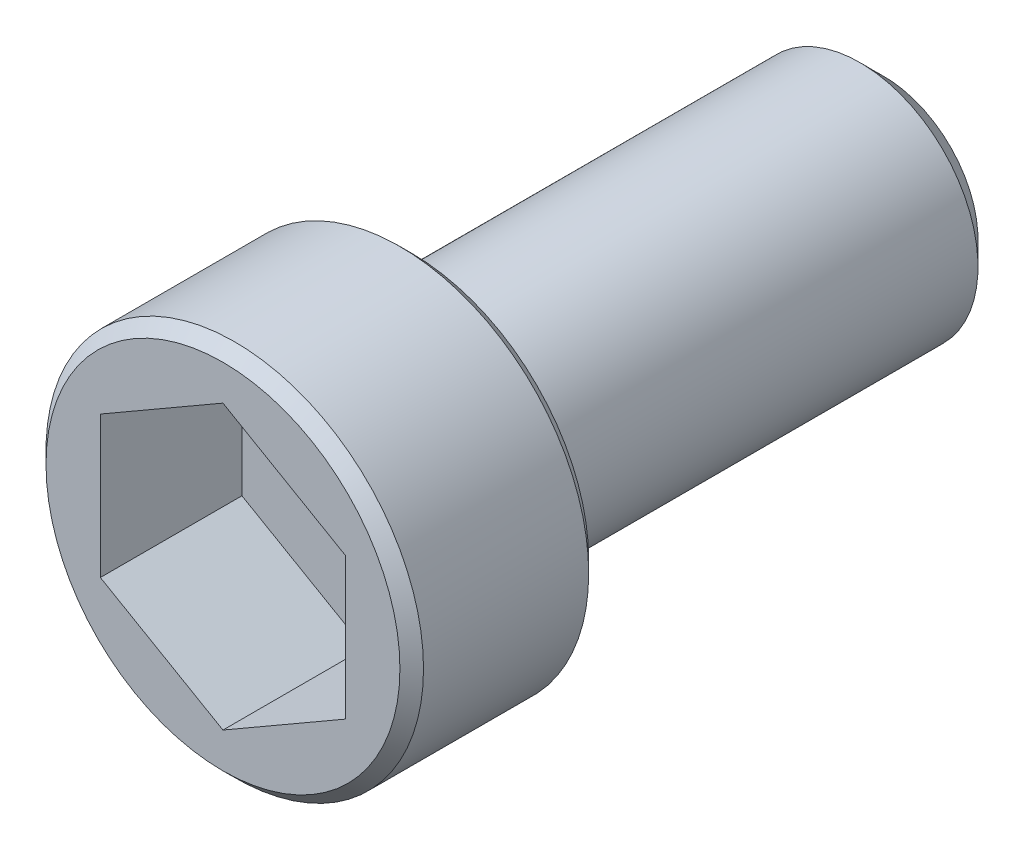
from build123d import *

# Parameters (mm, degrees)
SKETCH1_R           = 4
BOSS_EXTRUDE1_DEPTH = 4
CHAMFER1_SIZE       = 0.25
CUT_EXTRUDE1_DEPTH  = 3
SKETCH3_R           = 2.5
BOSS_EXTRUDE2_DEPTH = 10
CHAMFER2_SIZE       = 0.5


with BuildPart() as part:
    # Sketch1 → Boss-Extrude1 (new body)
    with BuildSketch(Plane(origin=(0, 0, 0), x_dir=(0, 1, 0), z_dir=(0, 0, 1))):
        with Locations(Location((0, 0, 0), (0, 0, 270))):
            Circle(SKETCH1_R)
    extrude(amount=-BOSS_EXTRUDE1_DEPTH)

    # Chamfer1
    chamfer1_edges = [part.edges().sort_by_distance(p)[0] for p in [
        (-4, 0, 0),
        (-4, 0, -4),
    ]]
    chamfer(chamfer1_edges, length=CHAMFER1_SIZE)

    # Sketch2 → Cut-Extrude1 (cut)
    with BuildSketch(Plane.XY):
        Polygon((0, 3), (-2.598076211, 1.5), (-2.598076211, -1.5), (0, -3), (2.598076211, -1.5), (2.598076211, 1.5), align=None)
    extrude(amount=-CUT_EXTRUDE1_DEPTH, mode=Mode.SUBTRACT)

    # Sketch3 → Boss-Extrude2 (add)
    with BuildSketch(Plane(origin=(0, 0, -4), x_dir=(1, 0, 0), z_dir=(0, 0, -1))):
        with Locations(Location((0, 0, 0), (0, 0, 180))):
            Circle(SKETCH3_R)
    extrude(amount=BOSS_EXTRUDE2_DEPTH)

    # Chamfer2
    chamfer2_edges = [part.edges().sort_by_distance(p)[0] for p in [
        (2.5, 0, -14),
    ]]
    chamfer(chamfer2_edges, length=CHAMFER2_SIZE)


solid = part.part
